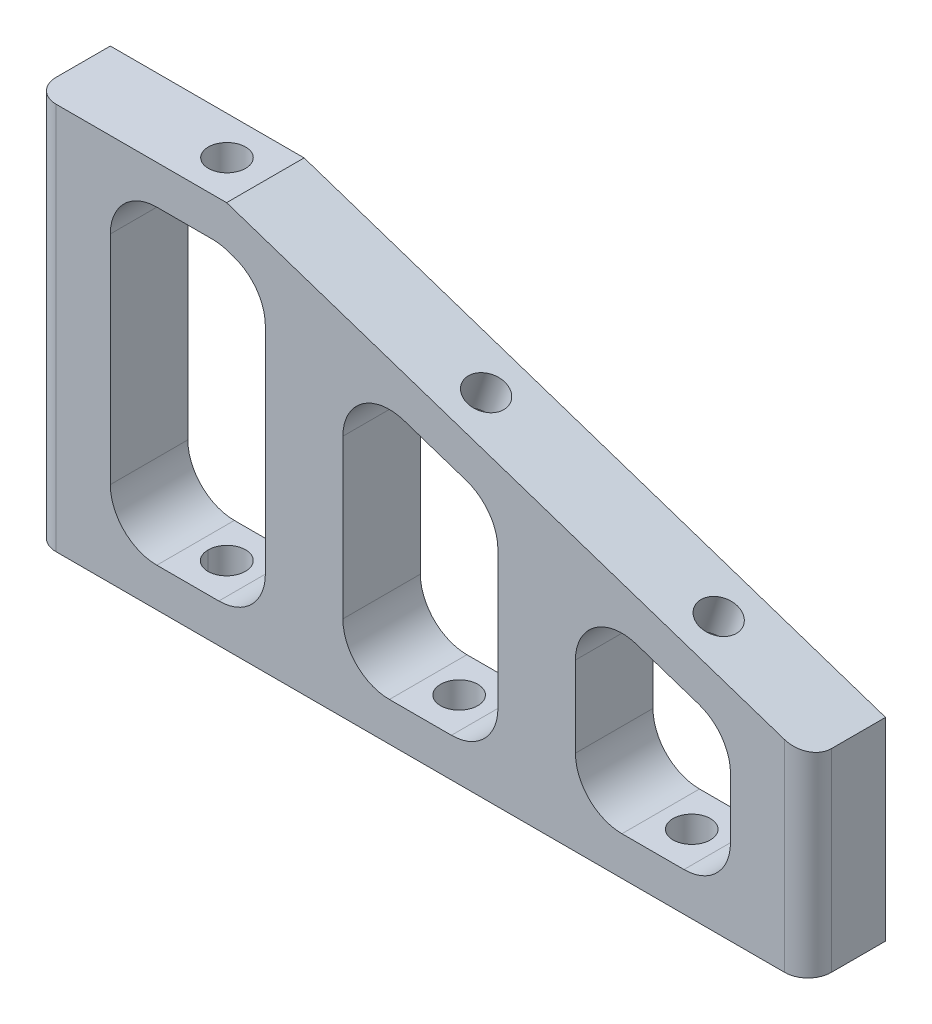
from build123d import *

# Parameters (mm, degrees)
BOSS_EXTRU_1_DEPTH      = 10
CONG_1_R                = 6
ESQUISSE3_R             = 2.4
ENL_V_MAT_EXTRU_1_DEPTH = 10
ESQUISSE4_R             = 2.4
ENL_V_MAT_EXTRU_2_DEPTH = 10
ESQUISSE5_R             = 2.4
ENL_V_MAT_EXTRU_3_DEPTH = 113.249721603
CONG_2_R                = 3


with BuildPart() as part:
    # Esquisse1 → Boss.-Extru.1 (new body)
    with BuildSketch(Plane.XY):
        Polygon((25, 50), (9.188611699, 50), (24.188611699, 45), (25, 45), align=None)
        Polygon((40, 45), (25, 50), (25, 45), (30, 45), (30, 43.062870566), (40, 39.729537233), align=None)
        Polygon((25, 45), (25, 44.729537233), (30, 43.062870566), (30, 45), align=None)
        Polygon((24.188611699, 45), (25, 44.729537233), (25, 45), align=None)
        Polygon((0, 50), (0, 25), (10, 25), (10, 45), (24.188611699, 45), (9.188611699, 50), align=None)
        Polygon((0, 25), (0, 0), (25, 0), (25, 5), (10, 5), (10, 25), align=None)
        Polygon((25, 5), (25, 0), (100, 0), (100, 19.729537233), (90, 23.062870566), (90, 5), (70, 5), (70, 25), (60, 25), (60, 5), (40, 5), (40, 25), (30, 25), (30, 5), align=None)
        Polygon((30, 43.062870566), (30, 25), (40, 25), (40, 39.729537233), align=None)
        Polygon((60, 38.333333333), (40, 45), (40, 39.729537233), (60, 33.062870566), align=None)
        Polygon((70, 29.729537233), (70, 35), (60, 38.333333333), (60, 33.062870566), align=None)
        Polygon((60, 25), (70, 25), (70, 29.729537233), (60, 33.062870566), align=None)
        Polygon((84.188611699, 25), (90, 25), (90, 28.333333333), (70, 35), (70, 29.729537233), align=None)
        Polygon((90, 25), (100, 25), (90, 28.333333333), align=None)
        Polygon((90, 23.062870566), (100, 19.729537233), (100, 25), (90, 25), align=None)
        Polygon((84.188611699, 25), (90, 23.062870566), (90, 25), align=None)
    extrude(amount=BOSS_EXTRU_1_DEPTH)

    # Congé1
    cong_1_edges = [part.edges().sort_by_distance(p)[0] for p in [
        (40, 39.729537233, 5),
        (40, 5, 5),
        (60, 5, 5),
        (60, 33.062870566, 5),
        (30, 43.062870566, 5),
        (24.188611699, 45, 5),
        (10, 45, 5),
        (10, 5, 5),
        (30, 5, 5),
        (70, 29.729537233, 5),
        (70, 5, 5),
        (90, 5, 5),
        (90, 23.062870566, 5),
    ]]
    fillet(cong_1_edges, radius=CONG_1_R)

    # Esquisse3 → Enlèv. mat.-Extru.1 (cut)
    with BuildSketch(Plane(origin=(15.91886117, 47.75658351, 0), x_dir=(0.9486832980505138, -0.31622776601683805, 0), z_dir=(-0.31622776601683805, -0.9486832980505138, 0))):
        with Locations((37.924674652, 5)):
            Circle(ESQUISSE3_R)
        with Locations((69.547451254, 5)):
            Circle(ESQUISSE3_R)
    extrude(amount=-ENL_V_MAT_EXTRU_1_DEPTH, mode=Mode.SUBTRACT)

    # Esquisse4 → Enlèv. mat.-Extru.2 (cut)
    with BuildSketch(Plane.XZ):
        with Locations(Location((20, 5, 0), (0, 0, 270))):
            Circle(ESQUISSE4_R)
        with Locations(Location((50, 5, 0), (0, 0, 270))):
            Circle(ESQUISSE4_R)
        with Locations(Location((80, 5, 0), (0, 0, 270))):
            Circle(ESQUISSE4_R)
    extrude(amount=-ENL_V_MAT_EXTRU_2_DEPTH, mode=Mode.SUBTRACT)

    # Esquisse5 → Enlèv. mat.-Extru.3 (cut, through all)
    with BuildSketch(Plane(origin=(0, 50, 0), x_dir=(1, 0, 0), z_dir=(0, 1, 0))):
        with Locations(Location((20, -4.950719268, 0), (0, 0, 270))):
            Circle(ESQUISSE5_R)
    extrude(amount=-ENL_V_MAT_EXTRU_3_DEPTH, mode=Mode.SUBTRACT)

    # Congé2
    cong_2_edges = [part.edges().sort_by_distance(p)[0] for p in [
        (100, 12.5, 10),
        (0, 25, 10),
    ]]
    fillet(cong_2_edges, radius=CONG_2_R)


solid = part.part
